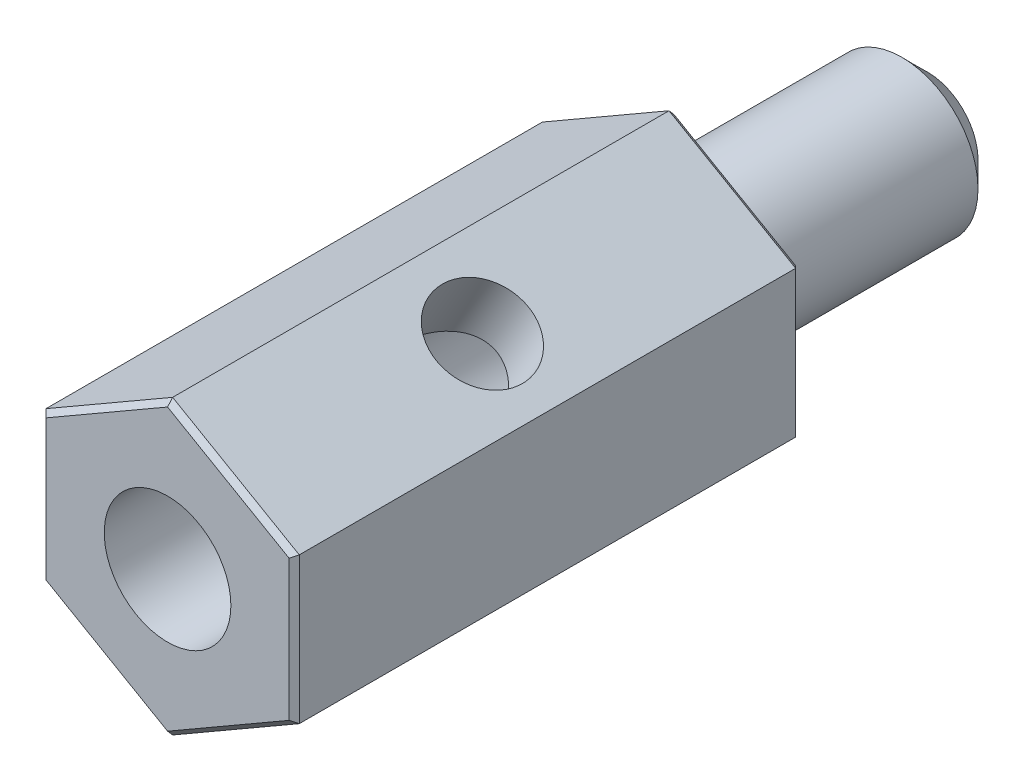
from build123d import *

# Parameters (mm, degrees)
DODANIE_WYCI_GNI_CIE1_DEPTH = 10
SZKIC2_R                    = 1.5
DODANIE_WYCI_GNI_CIE2_DEPTH = 5
SFAZOWANIE2_SIZE            = 0.5
OTW_R_GWINTOWANY_M31_D      = 2.5
OTW_R_GWINTOWANY_M31_DEPTH  = 8
OTW_R_GWINTOWANY_M31_TIP    = 0.751075774
SFAZOWANIE3_SIZE            = 0.1
SZKIC29_R                   = 0.91230631
WYTNIJ_WYCI_GNI_CIE1_DEPTH  = 12.814539066


with BuildPart() as part:
    # Szkic1 → Dodanie-wyciągnięcie1 (new body)
    with BuildSketch(Plane.XY):
        Polygon((0, 2.886751346), (-2.5, 1.443375673), (-2.5, -1.443375673), (0, -2.886751346), (2.5, -1.443375673), (2.5, 1.443375673), align=None)
    extrude(amount=DODANIE_WYCI_GNI_CIE1_DEPTH)

    # Szkic2 → Dodanie-wyciągnięcie2 (add)
    with BuildSketch(Plane(origin=(0, 0, 0), x_dir=(-1, 0, 0), z_dir=(0, 0, -1))):
        with Locations(Location((0, 0, 0), (0, 0, 180))):
            Circle(SZKIC2_R)
    extrude(amount=DODANIE_WYCI_GNI_CIE2_DEPTH)

    # Sfazowanie2
    sfazowanie2_edges = [part.edges().sort_by_distance(p)[0] for p in [
        (-1.5, 0, -5),
    ]]
    chamfer(sfazowanie2_edges, length=SFAZOWANIE2_SIZE)

    # Otwór gwintowany M31
    with Locations(Plane.XY.offset(10)):
        with Locations((0, 0)):
            Hole(OTW_R_GWINTOWANY_M31_D / 2, depth=OTW_R_GWINTOWANY_M31_DEPTH)
            with Locations((0, 0, -(OTW_R_GWINTOWANY_M31_DEPTH + OTW_R_GWINTOWANY_M31_TIP / 2))):  # 118° drill point
                Cone(0, OTW_R_GWINTOWANY_M31_D / 2, OTW_R_GWINTOWANY_M31_TIP, mode=Mode.SUBTRACT)

    # Sfazowanie3
    sfazowanie3_edges = [part.edges().sort_by_distance(p)[0] for p in [
        (-2.5, 0, 10),
        (-1.25, -2.165063509, 10),
        (1.25, -2.165063509, 10),
        (2.5, 0, 10),
        (1.25, 2.165063509, 10),
        (2.5, 0, 0),
        (1.25, -2.165063509, 0),
        (-1.25, -2.165063509, 0),
        (-1.25, 2.165063509, 10),
        (-2.5, 0, 0),
        (-1.25, 2.165063509, 0),
        (1.25, 2.165063509, 0),
    ]]
    chamfer(sfazowanie3_edges, length=SFAZOWANIE3_SIZE)

    # Szkic29 → Wytnij-wyciągnięcie1 (cut, through all)
    with BuildSketch(Plane(origin=(1.25, 2.165063509, 0), x_dir=(0.8660254037844415, -0.49999999999999517, 0), z_dir=(0.4999999999999951, 0.8660254037844414, 0))):
        with Locations(Location((0, -5.034184195, 0), (0, 0, 180))):
            Circle(SZKIC29_R)
    extrude(amount=-WYTNIJ_WYCI_GNI_CIE1_DEPTH, mode=Mode.SUBTRACT)


solid = part.part
